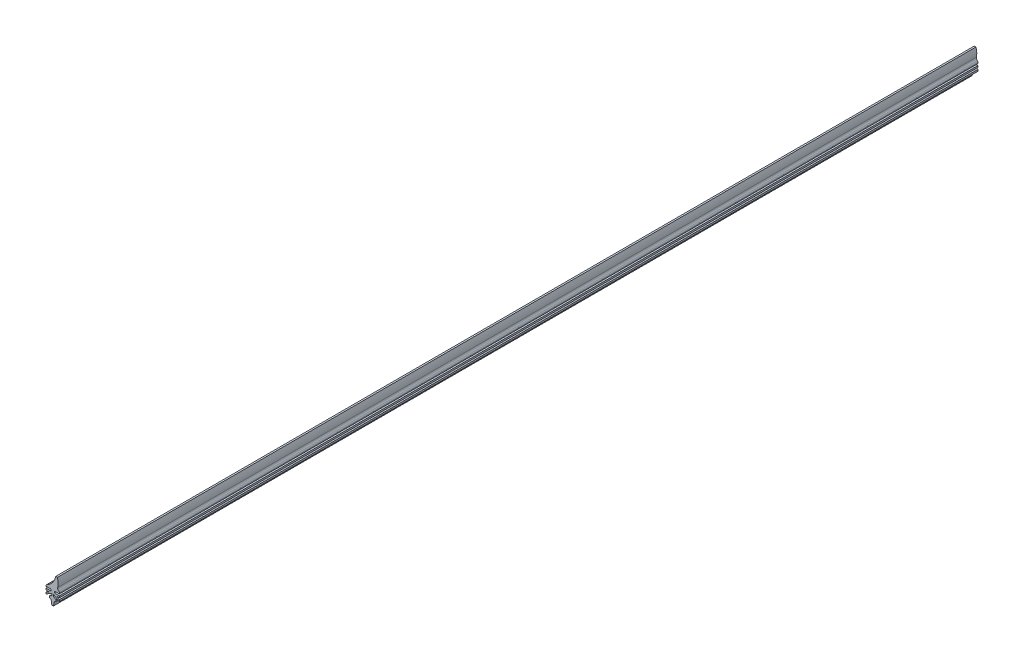
from build123d import *

# Parameters (mm, degrees)
EXTRUSION1_DEPTH = 550


with BuildPart() as part:
    # Esquisse1 → Extrusion1 (new body)
    with BuildSketch(Plane.XY):
        with BuildLine():
            Line((4, 0), (1, 0))
            Line((1, 0), (1, 1))
            Line((1, 1), (4, 1))
            Line((4, 1), (4, 1.5))
            ThreePointArc((4, 1.5), (3.894427191, 1.947213595), (3.6, 2.3))
            ThreePointArc((3.6, 2.3), (3.093760184, 2.977994654), (3.034989317, 3.822092686))
            ThreePointArc((3.034989317, 3.822092686), (3.257790087, 6.426670848), (2.797958971, 9))
            Line((2.797958971, 9), (1.797958971, 9))
            ThreePointArc((1.797958971, 9), (-0.040046913, 4.946972092), (-3.454545455, 2.092764572))
            ThreePointArc((-3.454545455, 2.092764572), (-3.852802865, 1.724273997), (-4, 1.202041029))
            Line((-4, 1.202041029), (-4, 1))
            Line((-4, 1), (-1, 1))
            Line((-1, 1), (-1, 0))
            Line((-1, 0), (-4, 0))
            Line((-4, 0), (-4, -1))
            Line((-4, -1), (-2.264690261, -1))
            Line((-2.264690261, -1), (-4, -2))
            Line((-4, -2), (-4, -3))
            Line((-4, -3), (-0.5, -0.983069005))
            Line((-0.5, -0.983069005), (-0.5, -2.13722779))
            Line((-0.5, -2.13722779), (-2, -3.001626788))
            Line((-2, -3.001626788), (-2, -4.001626788))
            Line((-2, -4.001626788), (-1.847051532, -4.001626788))
            ThreePointArc((-1.847051532, -4.001626788), (-1.200710202, -4.238578372), (-0.860672076, -4.837141017))
            Line((-0.860672076, -4.837141017), (-0.5, -7))
            Line((-0.5, -7), (0.5, -7))
            Line((0.5, -7), (0.860672076, -4.837141017))
            ThreePointArc((0.860672076, -4.837141017), (1.200710202, -4.238578372), (1.847051532, -4.001626788))
            Line((1.847051532, -4.001626788), (2, -4.001626788))
            Line((2, -4.001626788), (2, -3.001626788))
            Line((2, -3.001626788), (0.5, -2.13722779))
            Line((0.5, -2.13722779), (0.5, -0.983069005))
            Line((0.5, -0.983069005), (4, -3))
            Line((4, -3), (4, -2))
            Line((4, -2), (2.264690261, -1))
            Line((2.264690261, -1), (4, -1))
            Line((4, -1), (4, 0))
        make_face()
    extrude(amount=-EXTRUSION1_DEPTH)


solid = part.part
